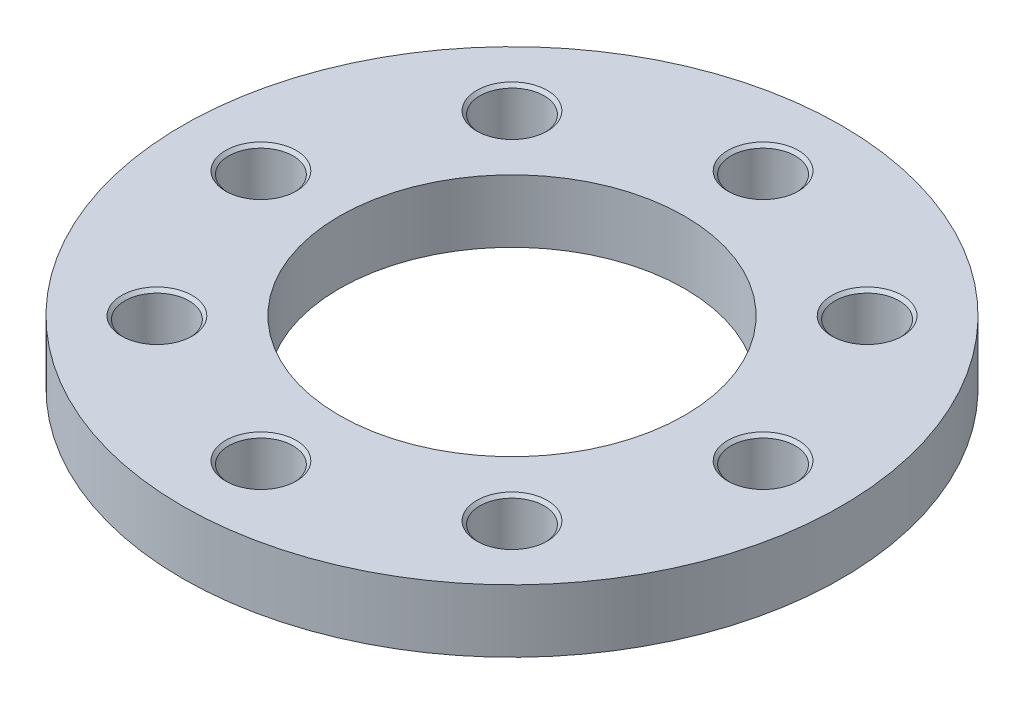
from build123d import *

# Parameters (mm, degrees)
SKETCH1_R                    = 21
SKETCH1_R_2                  = 16
SKETCH1_R_3                  = 11
BOSS_EXTRUDE1_DEPTH          = 4
SKETCH2_R                    = 2.05
CUT_EXTRUDE1_DEPTH           = 30.966648128
CHAMFER1_SIZE                = 0.2
CIRPATTERN1_COUNT            = 8
CHAMFER1_OF_CIRPATTERN1_SIZE = 0.2


with BuildPart() as part:
    # Sketch1 → Boss-Extrude1 (new body)
    # profile 1 of 2: a face of its own
    with BuildSketch(Plane(origin=(0, 0, 0), x_dir=(1, 0, 0), z_dir=(0, 1, 0))):
        with Locations(Location((0, 0, 0), (0, 0, 270))):
            Circle(SKETCH1_R)
        Circle(SKETCH1_R_2, mode=Mode.SUBTRACT)
    # profile 2 of 2: a face of its own
    with BuildSketch(Plane(origin=(0, 0, 0), x_dir=(1, 0, 0), z_dir=(0, 1, 0))):
        Circle(SKETCH1_R_2)
        with Locations(Location((0, 0, 0), (0, 0, 270))):
            Circle(SKETCH1_R_3, mode=Mode.SUBTRACT)
    extrude(amount=BOSS_EXTRUDE1_DEPTH)

    # Sketch2 → Cut-Extrude1 (cut, through all)
    with BuildSketch(Plane(origin=(0, 4, 0), x_dir=(1, 0, 0), z_dir=(0, 1, 0))):
        with Locations(Location((16, 0, 0), (0, 0, 270))):
            Circle(SKETCH2_R)
    cut_extrude1 = extrude(amount=-CUT_EXTRUDE1_DEPTH, mode=Mode.SUBTRACT)

    # Chamfer1
    chamfer1_edges = [part.edges().sort_by_distance(p)[0] for p in [
        (16, 0, -2.05),
        (16, 4, -2.05),
    ]]
    chamfer(chamfer1_edges, length=CHAMFER1_SIZE)

    # CirPattern1: Cut-Extrude1 ×8 about axis
    cirpattern1_axis = Axis((0, 0, 0), (0, 1, 0))
    for i in range(1, CIRPATTERN1_COUNT):
        add(cut_extrude1.rotate(cirpattern1_axis, i * 360 / CIRPATTERN1_COUNT), mode=Mode.SUBTRACT)

    # Chamfer1 of CirPattern1
    chamfer1_of_cirpattern1_edges = [part.edges().sort_by_distance(p)[0] for p in [
        (9.864139598, 0, -12.7632774),
        (9.864139598, 4, -12.7632774),
        (-2.05, 0, -16),
        (-2.05, 4, -16),
        (-12.7632774, 0, -9.864139598),
        (-12.7632774, 4, -9.864139598),
        (-16, 0, 2.05),
        (-16, 4, 2.05),
        (-9.864139598, 0, 12.7632774),
        (-9.864139598, 4, 12.7632774),
        (2.05, 0, 16),
        (2.05, 4, 16),
        (12.7632774, 0, 9.864139598),
        (12.7632774, 4, 9.864139598),
    ]]
    chamfer(chamfer1_of_cirpattern1_edges, length=CHAMFER1_OF_CIRPATTERN1_SIZE)


solid = part.part
